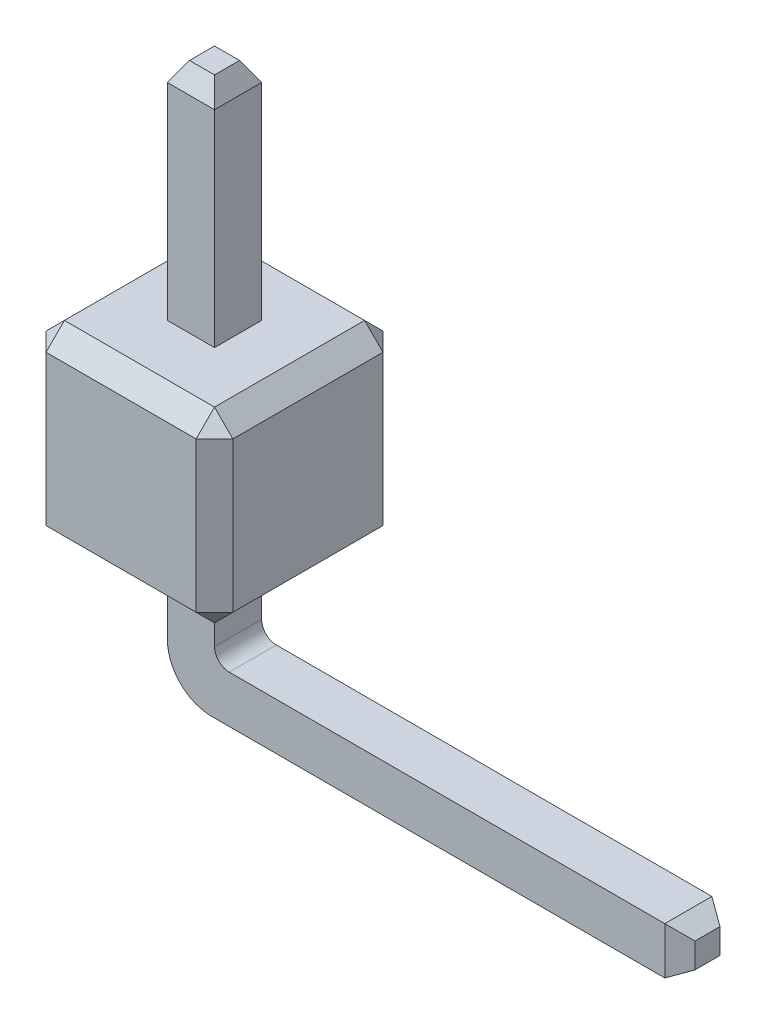
from build123d import *
from OCP.BRepFilletAPI import BRepFilletAPI_MakeChamfer

# Parameters (mm, degrees)
ESBO_O1_W                = 0.64
ESBO_O1_H                = 5.6
RESSALTO_EXTRUS_O1_DEPTH = 0.32
ESBO_O2_W                = 2.54
ESBO_O2_H                = 2.54
RESSALTO_EXTRUS_O2_DEPTH = 1.27
RESSALTO_EXTRUS_O3_DEPTH = 0.32
FILETE1_R                = 0.2
FILETE2_R                = 0.6
CHANFRO1_SIZE            = 0.15
CHANFRO1_SIZE2           = 0.26
CHANFRO2_SIZE            = 0.26
CHANFRO2_SIZE2           = 0.15
CHANFRO3_SIZE            = 0.25


with BuildPart() as part:
    # Esboço1 → Ressalto-extrusão1 (new, symmetric)
    with BuildSketch(Plane.XY):
        with Locations((0, 3)):
            Rectangle(ESBO_O1_W, ESBO_O1_H)
    extrude(amount=RESSALTO_EXTRUS_O1_DEPTH, both=True)

    # Esboço2 → Ressalto-extrusão2 (add, symmetric)
    with BuildSketch(Plane.XY):
        with Locations((0, 1.47)):
            Rectangle(ESBO_O2_W, ESBO_O2_H)
    extrude(amount=RESSALTO_EXTRUS_O2_DEPTH, both=True)

    # Esboço3 → Ressalto-extrusão3 (add, symmetric)
    with BuildSketch(Plane.XY):
        Polygon((0.32, 0.2), (-0.32, 0.2), (-0.32, -1.62), (6.7, -1.62), (6.7, -0.98), (0.32, -0.98), align=None)
    extrude(amount=RESSALTO_EXTRUS_O3_DEPTH, both=True)

    # Filete1
    filete1_edges = [part.edges().sort_by_distance(p)[0] for p in [
        (0.32, -0.98, 0),
    ]]
    fillet(filete1_edges, radius=FILETE1_R)

    # Filete2
    filete2_edges = [part.edges().sort_by_distance(p)[0] for p in [
        (-0.32, -1.62, 0),
    ]]
    fillet(filete2_edges, radius=FILETE2_R)

    # Chanfro1
    chanfro1_edges = [part.edges().sort_by_distance(p)[0] for p in [
        (0, 5.8, 0.32),
        (0, 5.8, -0.32),
        (-0.32, 5.8, 0),
        (0.32, 5.8, 0),
    ]]
    chanfro1_side = [part.faces().sort_by_distance(p)[0] for p in [
        (0, 5.8, 0),
    ]]
    chamfer(chanfro1_edges, length=CHANFRO1_SIZE, length2=CHANFRO1_SIZE2, reference=chanfro1_side[0])

    # Chanfro2: one chamfer whose edges measure the first distance from different faces: ONE call of the kernel's chamfer builder (chamfer() names one face for all edges)
    chanfro2_edges_1 = [part.edges().sort_by_distance(p)[0] for p in [
        (6.7, -1.3, 0.32),
    ]]
    chanfro2_side_1 = [part.faces().sort_by_distance(p)[0] for p in [
        (2.770539373, -1.16393397, 0.32),
    ]]
    chanfro2_edges_2 = [part.edges().sort_by_distance(p)[0] for p in [
        (6.7, -1.62, 0),
    ]]
    chanfro2_side_2 = [part.faces().sort_by_distance(p)[0] for p in [
        (3.49, -1.62, 0),
    ]]
    chanfro2_edges_3 = [part.edges().sort_by_distance(p)[0] for p in [
        (6.7, -0.98, 0),
    ]]
    chanfro2_side_3 = [part.faces().sort_by_distance(p)[0] for p in [
        (3.61, -0.98, 0),
    ]]
    chanfro2_edges_4 = [part.edges().sort_by_distance(p)[0] for p in [
        (6.7, -1.3, -0.32),
    ]]
    chanfro2_side_4 = [part.faces().sort_by_distance(p)[0] for p in [
        (2.770539373, -1.16393397, -0.32),
    ]]
    chanfro2 = BRepFilletAPI_MakeChamfer(part.part.solid().wrapped)
    for e in chanfro2_edges_1:
        chanfro2.Add(CHANFRO2_SIZE, CHANFRO2_SIZE2, e.wrapped, chanfro2_side_1[0].wrapped)  # the first distance lies on this face
    for e in chanfro2_edges_2:
        chanfro2.Add(CHANFRO2_SIZE, CHANFRO2_SIZE2, e.wrapped, chanfro2_side_2[0].wrapped)  # the first distance lies on this face
    for e in chanfro2_edges_3:
        chanfro2.Add(CHANFRO2_SIZE, CHANFRO2_SIZE2, e.wrapped, chanfro2_side_3[0].wrapped)  # the first distance lies on this face
    for e in chanfro2_edges_4:
        chanfro2.Add(CHANFRO2_SIZE, CHANFRO2_SIZE2, e.wrapped, chanfro2_side_4[0].wrapped)  # the first distance lies on this face
    add(Compound.cast(chanfro2.Shape()), mode=Mode.REPLACE)

    # Chanfro3
    chanfro3_edges = [part.edges().sort_by_distance(p)[0] for p in [
        (0, 0.2, -1.27),
        (-1.27, 0.2, 0),
        (0, 2.74, -1.27),
        (1.27, 2.74, 0),
        (-1.27, 1.47, -1.27),
        (-1.27, 2.74, 0),
        (1.27, 1.47, -1.27),
        (1.27, 0.2, 0),
        (-1.27, 1.47, 1.27),
        (0, 0.2, 1.27),
        (1.27, 1.47, 1.27),
        (0, 2.74, 1.27),
    ]]
    chamfer(chanfro3_edges, length=CHANFRO3_SIZE)


solid = part.part
